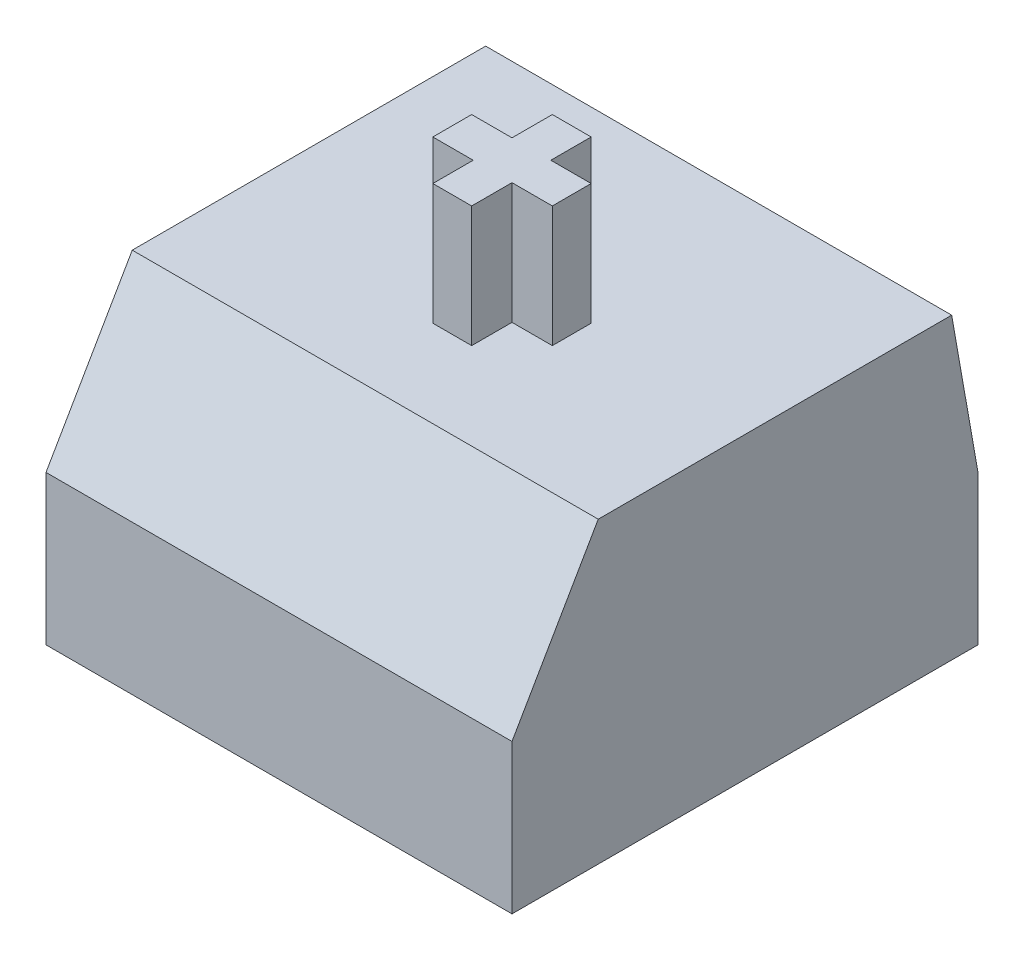
from build123d import *

# Parameters (mm, degrees)
SKETCH1_W           = 15.6
SKETCH1_H           = 15.6
BOSS_EXTRUDE1_DEPTH = 5
BOSS_EXTRUDE2_DEPTH = 7.8
BOSS_EXTRUDE3_DEPTH = 4.05
SKETCH4_R           = 1.925
BOSS_EXTRUDE4_DEPTH = 3
SKETCH6_R           = 0.65
BOSS_EXTRUDE5_DEPTH = 4


with BuildPart() as part:
    # Sketch1 → Boss-Extrude1 (new body)
    with BuildSketch(Plane(origin=(0, 0, 0), x_dir=(1, 0, 0), z_dir=(0, 1, 0))):
        Rectangle(SKETCH1_W, SKETCH1_H)
    extrude(amount=BOSS_EXTRUDE1_DEPTH)

    # Sketch2 → Boss-Extrude2 (add, symmetric)
    with BuildSketch(Plane(origin=(0, 0, 0), x_dir=(0, 0, -1), z_dir=(1, 0, 0))):
        Polygon((-7.8, 5), (7.8, 5), (6.918365096, 10), (-4.913248654, 10), align=None)
    extrude(amount=BOSS_EXTRUDE2_DEPTH, both=True)

    # Sketch3 → Boss-Extrude3 (add)
    with BuildSketch(Plane(origin=(0, 10, 0), x_dir=(1, 0, 0), z_dir=(0, 1, 0))):
        Polygon((-0.65, 2), (0.65, 2), (0.65, 0.65), (2, 0.65), (2, -0.65), (0.65, -0.65), (0.65, -2), (-0.65, -2), (-0.65, -0.65), (-2, -0.65), (-2, 0.65), (-0.65, 0.65), align=None)
    extrude(amount=BOSS_EXTRUDE3_DEPTH)

    # Sketch4 → Boss-Extrude4 (add)
    with BuildSketch(Plane(origin=(0, 0, 0), x_dir=(1, 0, 0), z_dir=(0, 1, 0))):
        with Locations(Location((0, 0, 0), (0, 0, 270))):
            Circle(SKETCH4_R)
    extrude(amount=-BOSS_EXTRUDE4_DEPTH)

    # Sketch6 → Boss-Extrude5 (add)
    with BuildSketch(Plane(origin=(0, 0, 0), x_dir=(1, 0, 0), z_dir=(0, 1, 0))):
        with Locations(Location((2.54, 5.08, 0), (0, 0, 270))):
            Circle(SKETCH6_R)
        with Locations(Location((-3.81, 2.54, 0), (0, 0, 270))):
            Circle(SKETCH6_R)
    extrude(amount=-BOSS_EXTRUDE5_DEPTH)


solid = part.part
